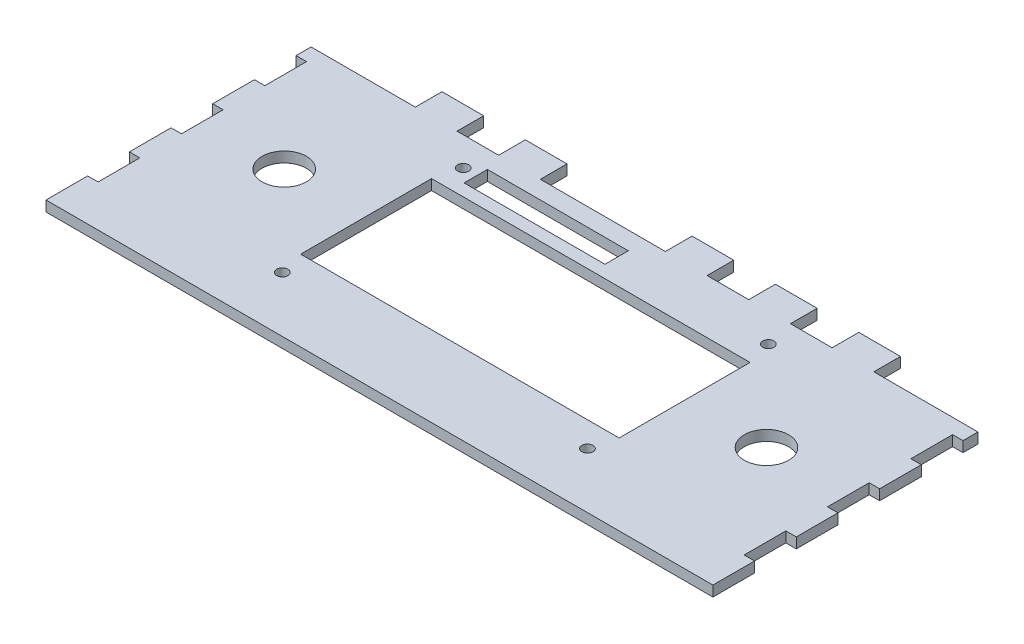
from build123d import *

# Parameters (mm, degrees)
SKETCH1_W             = 203.2
SKETCH1_H             = 88.9
BOSS_EXTRUDE1_DEPTH   = 3.175
SKETCH2_W             = 31.75
SKETCH2_H             = 8.128
SKETCH2_W_2           = 3.175
SKETCH2_H_2           = 12.7
SKETCH2_W_3           = 12.7
SKETCH2_W_4           = 38.1
CUT_EXTRUDE1_DEPTH    = 222.818688629
SKETCH3_W             = 97.028
SKETCH3_H             = 39.878
SKETCH3_W_2           = 42.926
SKETCH3_H_2           = 7.112
CUT_EXTRUDE2_DEPTH    = 222.818688629
M3_CLEARANCE_HOLE1_D  = 3.4
M12_CLEARANCE_HOLE1_D = 13.5


with BuildPart() as part:
    # Sketch1 → Boss-Extrude1 (new body)
    with BuildSketch(Plane(origin=(0, 0, 0), x_dir=(1, 0, 0), z_dir=(0, 1, 0))):
        with Locations((101.6, 44.45)):
            Rectangle(SKETCH1_W, SKETCH1_H)
    extrude(amount=BOSS_EXTRUDE1_DEPTH)

    # Sketch2 → Cut-Extrude1 (cut, through all)
    with BuildSketch(Plane(origin=(0, 3.175, 0), x_dir=(1, 0, 0), z_dir=(0, 1, 0))):
        with Locations((15.875, 84.836)):
            Rectangle(SKETCH2_W, SKETCH2_H)
        with Locations((1.5875, 44.45)):
            Rectangle(SKETCH2_W_2, SKETCH2_H_2)
        with Locations((1.5875, 69.85)):
            Rectangle(SKETCH2_W_2, SKETCH2_H_2)
        with Locations((1.5875, 19.05)):
            Rectangle(SKETCH2_W_2, SKETCH2_H_2)
        with Locations((50.8, 84.836)):
            Rectangle(SKETCH2_W_3, SKETCH2_H)
        with Locations((88.9, 84.836)):
            Rectangle(SKETCH2_W_4, SKETCH2_H)
        with Locations((127, 84.836)):
            Rectangle(SKETCH2_W_3, SKETCH2_H)
        with Locations((152.4, 84.836)):
            Rectangle(SKETCH2_W_3, SKETCH2_H)
        with Locations((187.325, 84.836)):
            Rectangle(SKETCH2_W, SKETCH2_H)
        with Locations((201.6125, 19.05)):
            Rectangle(SKETCH2_W_2, SKETCH2_H_2)
        with Locations((201.6125, 44.45)):
            Rectangle(SKETCH2_W_2, SKETCH2_H_2)
        with Locations((201.6125, 69.85)):
            Rectangle(SKETCH2_W_2, SKETCH2_H_2)
    extrude(amount=-CUT_EXTRUDE1_DEPTH, mode=Mode.SUBTRACT)

    # Sketch3 → Cut-Extrude2 (cut, through all)
    with BuildSketch(Plane.XZ):
        with Locations((101.6, -44.45)):
            Rectangle(SKETCH3_W, SKETCH3_H)
        with Locations((80.645, -71.755)):
            Rectangle(SKETCH3_W_2, SKETCH3_H_2)
    extrude(amount=-CUT_EXTRUDE2_DEPTH, mode=Mode.SUBTRACT)

    # M3 Clearance Hole1 (through all)
    with Locations(Plane(origin=(0, 0, 0), x_dir=(-1, 0, 0), z_dir=(0, -1, 0))):
        with Locations((-148.082, 72.009), (-148.082, 16.891), (-55.118, 16.891), (-55.118, 72.009)):
            Hole(M3_CLEARANCE_HOLE1_D / 2)

    # M12 Clearance Hole1 (through all)
    with Locations(Plane(origin=(0, 0, 0), x_dir=(-1, 0, 0), z_dir=(0, -1, 0))):
        with Locations((-175.0695, 44.45), (-28.1305, 44.45)):
            Hole(M12_CLEARANCE_HOLE1_D / 2)


solid = part.part
